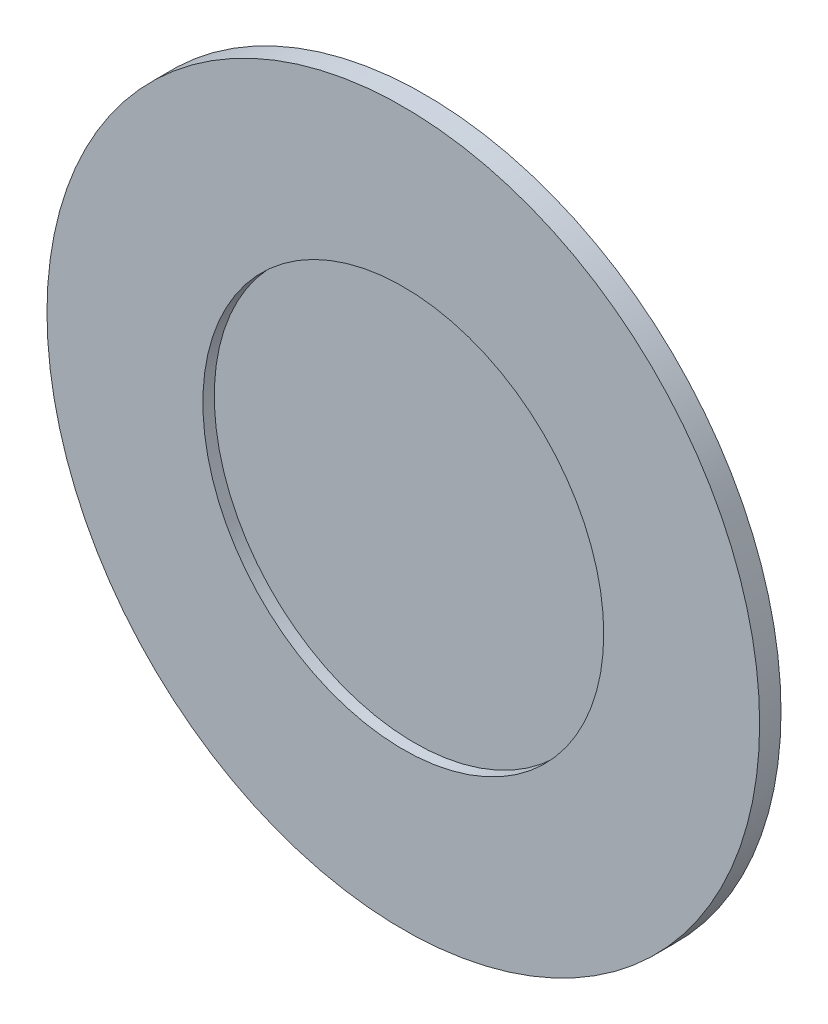
from build123d import *

# Parameters (mm, degrees)
SKETCH1_R           = 6.35
BOSS_EXTRUDE1_DEPTH = 0.381
CUT_EXTRUDE2_START  = 0.381
SKETCH1_3_R         = 3.571875
CUT_EXTRUDE2_DEPTH  = 0.2032


with BuildPart() as part:
    # Sketch1 → Boss-Extrude1 (new body)
    with BuildSketch(Plane.XY):
        with Locations(Location((0, 0, 0), (0, 0, 180))):
            Circle(SKETCH1_R)
    extrude(amount=BOSS_EXTRUDE1_DEPTH)

    # Sketch1<3> → Cut-Extrude2 (cut)
    with BuildSketch(Plane.XY.offset(CUT_EXTRUDE2_START)):
        Circle(SKETCH1_3_R)
    extrude(amount=-CUT_EXTRUDE2_DEPTH, mode=Mode.SUBTRACT)


solid = part.part
